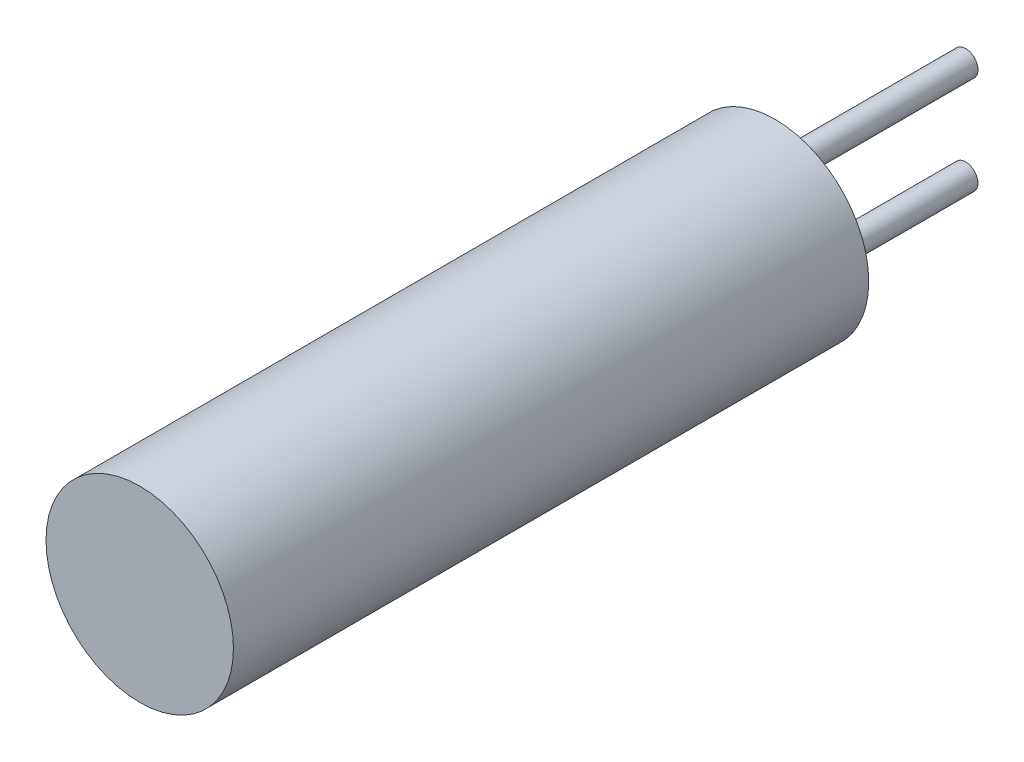
from build123d import *

# Parameters (mm, degrees)
CROQUIS5_R                = 0.389818599
SALIENTE_EXTRUIR3_DEPTH   = 6
SALIENTE_EXTRUIR3_2_DEPTH = 6
CROQUIS4_R                = 2.95
SALIENTE_EXTRUIR4_DEPTH   = 20


with BuildPart() as part:
    # Croquis5 → Saliente-Extruir3 (new body)
    with BuildSketch(Plane.XY):
        with Locations((0, 1.489822979)):
            Circle(CROQUIS5_R)
    extrude(amount=-SALIENTE_EXTRUIR3_DEPTH)


with BuildPart() as body_2:
    # Croquis5 → Saliente-Extruir3 2 (new body)
    with BuildSketch(Plane.XY):
        with Locations((0, -1.60226245)):
            Circle(CROQUIS5_R)
    extrude(amount=-SALIENTE_EXTRUIR3_2_DEPTH)


with BuildPart() as body_3:
    # Croquis4 → Saliente-Extruir4 (new body)
    with BuildSketch(Plane.XY):
        Circle(CROQUIS4_R)
    extrude(amount=SALIENTE_EXTRUIR4_DEPTH)


solid = Compound([part.part, body_2.part, body_3.part])
